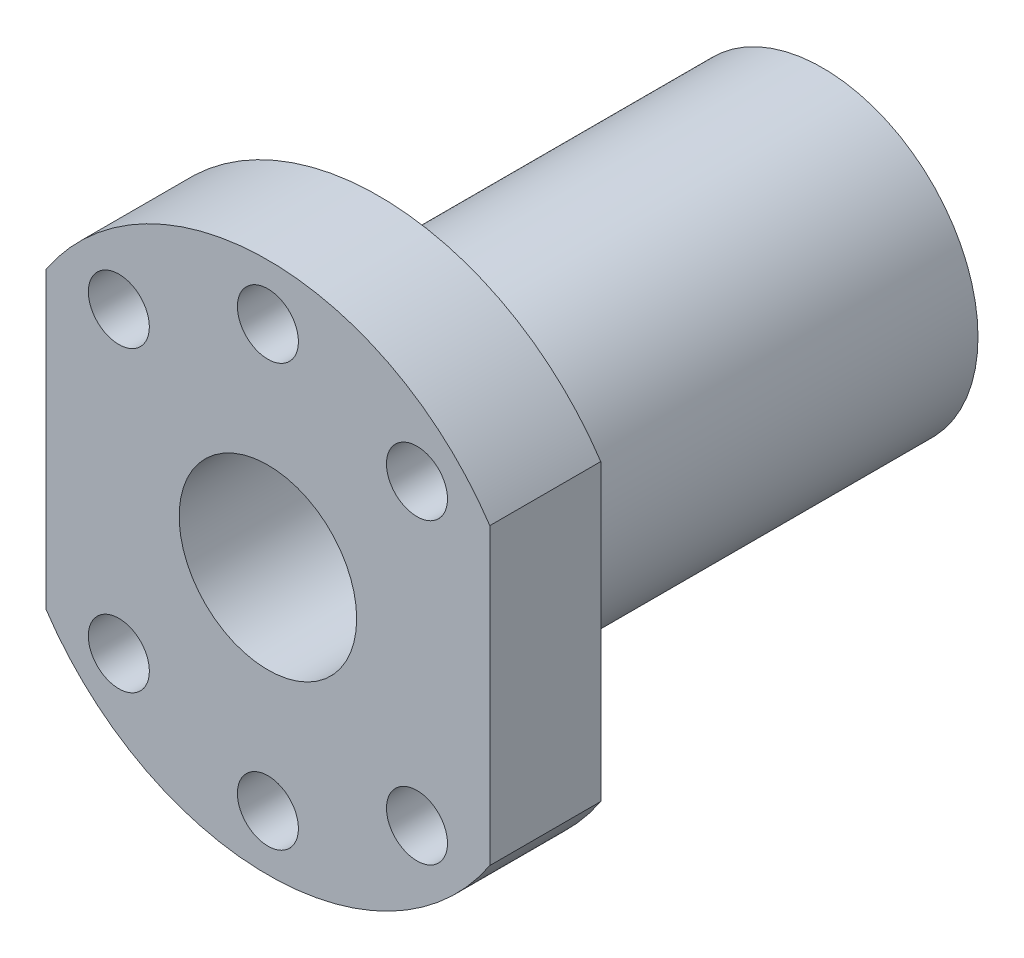
from build123d import *

# Parameters (mm, degrees)
SWEEP1_PITCH       = 5
SWEEP1_HEIGHT      = 35
SWEEP1_RADIUS      = 8
SWEEP1_START_ANGLE = 45
SKETCH9_R          = 1.6
CUT_EXTRUDE4_REACH = 62.432
SKETCH13_R         = 2.75


with BuildPart() as part:
    # Sketch7 → Revolve1 (revolve)
    with BuildSketch(Plane(origin=(0, 0, 0), x_dir=(0, 0, -1), z_dir=(1, 0, 0)), mode=Mode.PRIVATE) as revolve1_sk:
        Polygon((0, 8), (0, 24), (10, 24), (10, 14), (50, 14), (50, 8), align=None)
    revolve(revolve1_sk.sketch.rotate(Axis((0, 0, 22.731042651), (0, 0, -1)), 90), axis=Axis((0, 0, 22.731042651), (0, 0, -1)))

    # Sweep1: sweep along a helix
    with BuildLine() as sweep1_path:
        add(Helix(SWEEP1_PITCH, SWEEP1_HEIGHT, SWEEP1_RADIUS, center=(0, 0, -10), direction=(0, 0, -1), mode=Mode.PRIVATE).rotate(Axis((0, 0, -10), (0, 0, -1)), SWEEP1_START_ANGLE))
    # Sketch9 → Sweep1 (sweep)
    with BuildSketch(Plane(origin=(-5.656854249, 5.656854249, -10), x_dir=(0.7103558854832264, -0.6932133669081867, 0.12185952527052364), z_dir=(0.7036342437521906, 0.7036342437521973, -0.09898334222765079))):
        Circle(SKETCH9_R)
    sweep(path=sweep1_path.line, is_frenet=True)

    # Sketch13 → Cut-Extrude4 (cut, up to next)
    with BuildSketch(Plane.XY, mode=Mode.PRIVATE) as cut_extrude4_sk1:
        with Locations((0, 19)):
            Circle(SKETCH13_R)
    cut_extrude4_tool1 = extrude(cut_extrude4_sk1.sketch, amount=-CUT_EXTRUDE4_REACH, mode=Mode.PRIVATE) & part.part
    # Sketch13 → Cut-Extrude4 (cut, up to next)
    with BuildSketch(Plane.XY, mode=Mode.PRIVATE) as cut_extrude4_sk2:
        with Locations((13.435028843, 13.435028843)):
            Circle(SKETCH13_R)
    cut_extrude4_tool2 = extrude(cut_extrude4_sk2.sketch, amount=-CUT_EXTRUDE4_REACH, mode=Mode.PRIVATE) & part.part
    # Sketch13 → Cut-Extrude4 (cut, up to next)
    with BuildSketch(Plane.XY, mode=Mode.PRIVATE) as cut_extrude4_sk3:
        with Locations((13.435028843, -13.435028843)):
            Circle(SKETCH13_R)
    cut_extrude4_tool3 = extrude(cut_extrude4_sk3.sketch, amount=-CUT_EXTRUDE4_REACH, mode=Mode.PRIVATE) & part.part
    # Sketch13 → Cut-Extrude4 (cut, up to next)
    with BuildSketch(Plane.XY, mode=Mode.PRIVATE) as cut_extrude4_sk4:
        with Locations((0, -19)):
            Circle(SKETCH13_R)
    cut_extrude4_tool4 = extrude(cut_extrude4_sk4.sketch, amount=-CUT_EXTRUDE4_REACH, mode=Mode.PRIVATE) & part.part
    # Sketch13 → Cut-Extrude4 (cut, up to next)
    with BuildSketch(Plane.XY, mode=Mode.PRIVATE) as cut_extrude4_sk5:
        with Locations((-13.435028843, -13.435028843)):
            Circle(SKETCH13_R)
    cut_extrude4_tool5 = extrude(cut_extrude4_sk5.sketch, amount=-CUT_EXTRUDE4_REACH, mode=Mode.PRIVATE) & part.part
    # Sketch13 → Cut-Extrude4 (cut, up to next)
    with BuildSketch(Plane.XY, mode=Mode.PRIVATE) as cut_extrude4_sk6:
        with Locations((-13.435028843, 13.435028843)):
            Circle(SKETCH13_R)
    cut_extrude4_tool6 = extrude(cut_extrude4_sk6.sketch, amount=-CUT_EXTRUDE4_REACH, mode=Mode.PRIVATE) & part.part
    # Sketch13 → Cut-Extrude4 (cut, up to next)
    with BuildSketch(Plane.XY, mode=Mode.PRIVATE) as cut_extrude4_sk7:
        with BuildLine():
            Line((20, -13.266499161), (20, 13.266499161))
            ThreePointArc((20, 13.266499161), (24, 0), (20, -13.266499161))
        make_face()
    cut_extrude4_tool7 = extrude(cut_extrude4_sk7.sketch, amount=-CUT_EXTRUDE4_REACH, mode=Mode.PRIVATE) & part.part
    # Sketch13 → Cut-Extrude4 (cut, up to next)
    with BuildSketch(Plane.XY, mode=Mode.PRIVATE) as cut_extrude4_sk8:
        with BuildLine():
            Line((-20, -13.266499161), (-20, 13.266499161))
            ThreePointArc((-20, 13.266499161), (-24, 0), (-20, -13.266499161))
        make_face()
    cut_extrude4_tool8 = extrude(cut_extrude4_sk8.sketch, amount=-CUT_EXTRUDE4_REACH, mode=Mode.PRIVATE) & part.part
    add(cut_extrude4_tool1.solids().sort_by_distance((0, 19, 0))[0], mode=Mode.SUBTRACT)
    add(cut_extrude4_tool2.solids().sort_by_distance((13.435029, 13.435029, 0))[0], mode=Mode.SUBTRACT)
    add(cut_extrude4_tool3.solids().sort_by_distance((13.435029, -13.435029, 0))[0], mode=Mode.SUBTRACT)
    add(cut_extrude4_tool4.solids().sort_by_distance((0, -19, 0))[0], mode=Mode.SUBTRACT)
    add(cut_extrude4_tool5.solids().sort_by_distance((-13.435029, -13.435029, 0))[0], mode=Mode.SUBTRACT)
    add(cut_extrude4_tool6.solids().sort_by_distance((-13.435029, 13.435029, 0))[0], mode=Mode.SUBTRACT)
    add(cut_extrude4_tool7.solids().sort_by_distance((21.612009, 0, 0))[0], mode=Mode.SUBTRACT)
    add(cut_extrude4_tool8.solids().sort_by_distance((-21.612009, 0, 0))[0], mode=Mode.SUBTRACT)


solid = part.part
